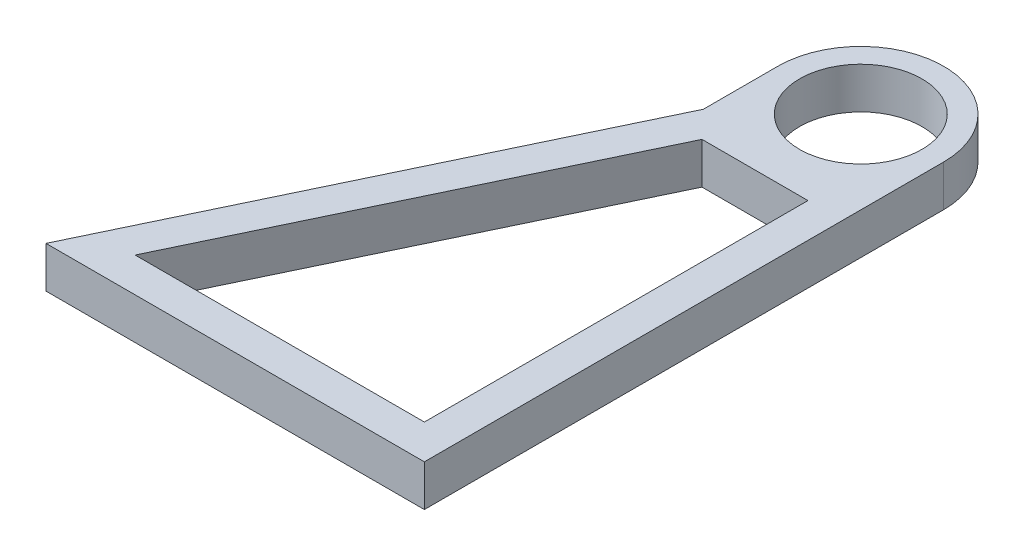
from build123d import *

# Parameters (mm, degrees)
SKETCH1_R           = 17.75
BOSS_EXTRUDE1_DEPTH = 12
CUT_EXTRUDE1_DEPTH  = 37


with BuildPart() as part:
    # Sketch1 → Boss-Extrude1 (new body)
    with BuildSketch(Plane(origin=(0, 0, 0), x_dir=(1, 0, 0), z_dir=(0, 1, 0))):
        with BuildLine():
            Line((-85.725, -150.69249853), (24.062600581, -150.69249853))
            Line((24.062600581, -150.69249853), (24.062600581, 0))
            ThreePointArc((24.062600581, 0), (0, 24.062600581), (-24.062600581, 0))
            Line((-24.062600581, 0), (-24.062600581, -21.619479895))
            Line((-24.062600581, -21.619479895), (-85.725, -150.69249853))
        make_face()
        with Locations(Location((0, 0, 0), (0, 0, 270))):
            Circle(SKETCH1_R, mode=Mode.SUBTRACT)
    extrude(amount=BOSS_EXTRUDE1_DEPTH)

    # Sketch3 → Cut-Extrude1 (cut)
    with BuildSketch(Plane.XZ):
        Polygon((14.062600581, 46.322856575), (14.062600581, 29.384281384), (-16.689552863, 29.384281384), (-69.865126015, 140.69249853), (14.062600581, 140.69249853), align=None)
    extrude(amount=-CUT_EXTRUDE1_DEPTH, mode=Mode.SUBTRACT)


solid = part.part
